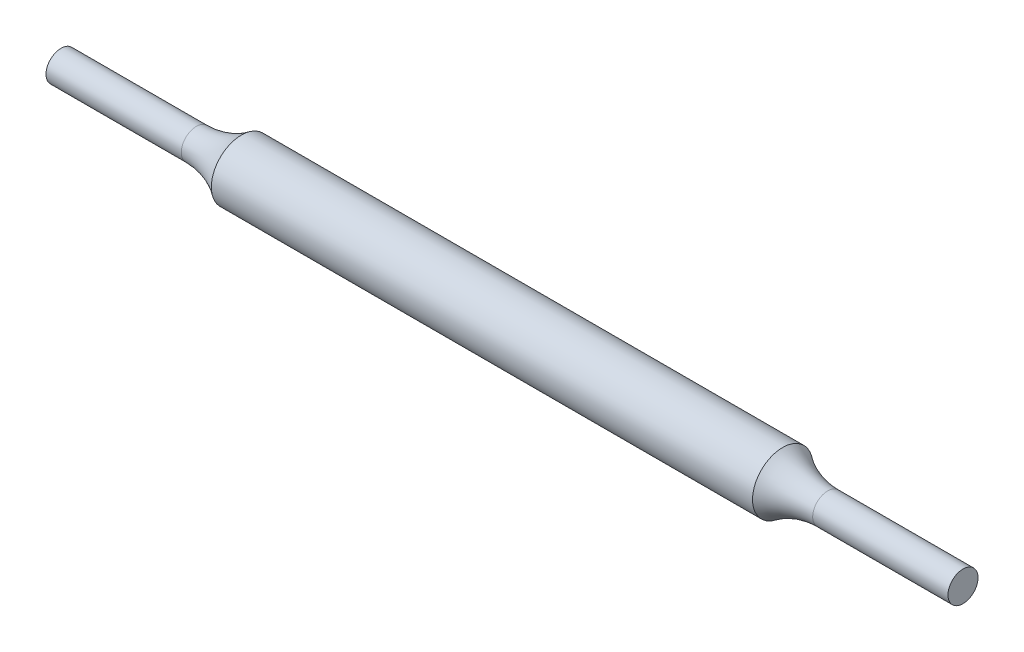
from build123d import *


with BuildPart() as part:
    # Sketch1 → Revolve2 (revolve)
    with BuildSketch(Plane(origin=(0, 0, 0), x_dir=(1, 0, 0), z_dir=(0, 1, 0)), mode=Mode.PRIVATE) as revolve2_sk:
        with BuildLine():
            Line((0, 0), (60, 0))
            Line((60, 0), (60, 1))
            Line((60, 1), (51, 1))
            ThreePointArc((51, 1), (49.41886117, 1.25658351), (48, 2))
            Line((48, 2), (12, 2))
            ThreePointArc((12, 2), (10.58113883, 1.25658351), (9, 1))
            Line((9, 1), (0, 1))
            Line((0, 1), (0, 0))
        make_face()
    revolve(revolve2_sk.sketch.rotate(Axis((0, 0, 0), (1, 0, 0)), 180), axis=Axis((0, 0, 0), (1, 0, 0)))


solid = part.part
